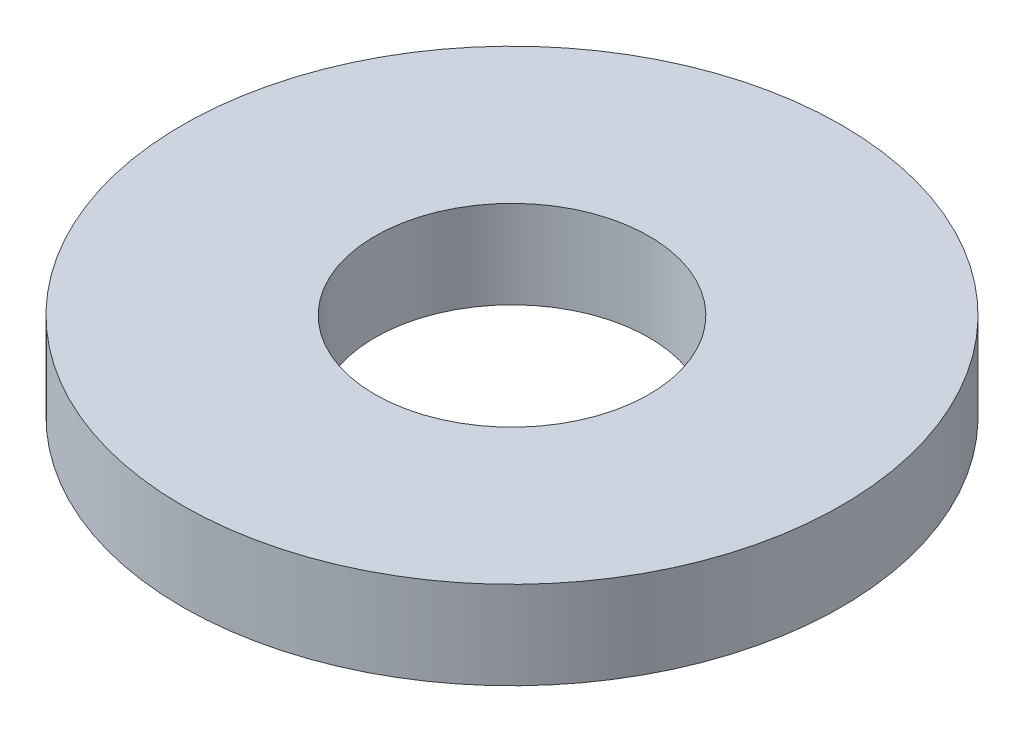
from build123d import *

# Parameters (mm, degrees)
SKETCH1_R           = 2.38125
BOSS_EXTRUDE1_DEPTH = 0.635
SKETCH5_R           = 0.9906
CUT_EXTRUDE1_DEPTH  = 4.426941512


with BuildPart() as part:
    # Sketch1 → Boss-Extrude1 (new body)
    with BuildSketch(Plane(origin=(0, 0, 0), x_dir=(1, 0, 0), z_dir=(0, 1, 0))):
        with Locations(Location((0, 0, 0), (0, 0, 270))):
            Circle(SKETCH1_R)
    extrude(amount=BOSS_EXTRUDE1_DEPTH)

    # Sketch5 → Cut-Extrude1 (cut, through all)
    with BuildSketch(Plane(origin=(0, 0.635, 0), x_dir=(-1, 0, 0), z_dir=(0, 1, 0))):
        with Locations(Location((0, 0, 0), (0, 0, 90))):
            Circle(SKETCH5_R)
    extrude(amount=-CUT_EXTRUDE1_DEPTH, mode=Mode.SUBTRACT)


solid = part.part
